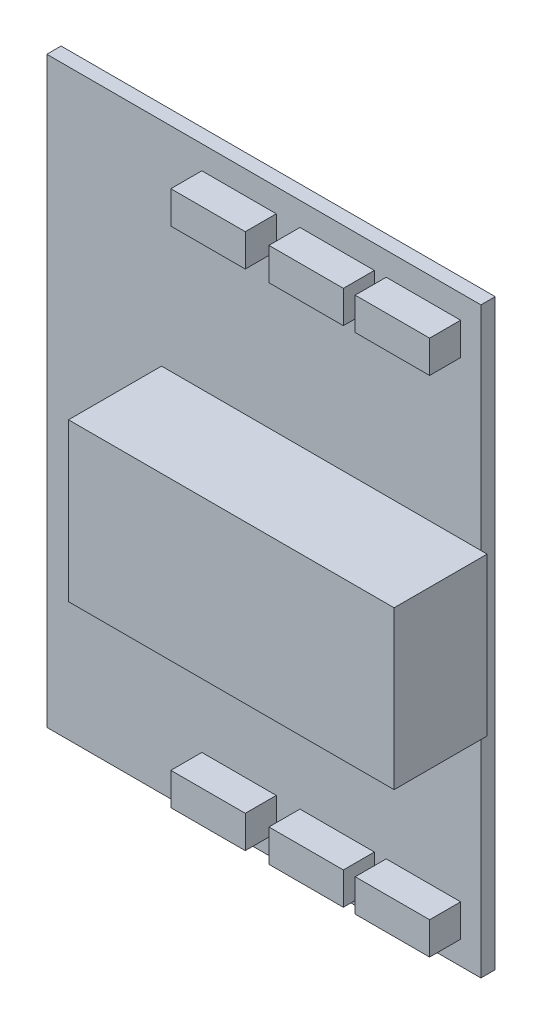
from build123d import *

# Parameters (mm, degrees)
SKETCH2_W           = 70
SKETCH2_H           = 94
BOSS_EXTRUDE1_DEPTH = 2.3
SKETCH3_W           = 51.5
SKETCH3_H           = 12.7
BOSS_EXTRUDE2_DEPTH = 15
SKETCH4_W           = 12
SKETCH4_H           = 5.220497566
BOSS_EXTRUDE3_DEPTH = 5


with BuildPart() as part:
    # Sketch2 → Boss-Extrude1 (new body)
    with BuildSketch(Plane.XY):
        Rectangle(SKETCH2_W, SKETCH2_H)
    extrude(amount=BOSS_EXTRUDE1_DEPTH)

    # Sketch3 → Boss-Extrude2 (add)
    with BuildSketch(Plane.XY.offset(2.3)):
        with Locations((9.25, 6.35)):
            Rectangle(SKETCH3_W, SKETCH3_H)
        with Locations((9.25, -6.35)):
            Rectangle(SKETCH3_W, SKETCH3_H)
        Polygon((35, 12.7), (35, 0), (35, -12.7), (36, -12.7), (36, 12.7), align=None)
    extrude(amount=BOSS_EXTRUDE2_DEPTH)

    # Sketch4 → Boss-Extrude3 (add)
    with BuildSketch(Plane.XY.offset(2.3)):
        with Locations((-4, 40.610248783)):
            Rectangle(SKETCH4_W, SKETCH4_H)
        with Locations((11.818181083, 40.610248783)):
            Rectangle(SKETCH4_W, SKETCH4_H)
        with Locations((25.725310397, 40.610248783)):
            Rectangle(SKETCH4_W, SKETCH4_H)
        with Locations((-4, -40.610248783)):
            Rectangle(SKETCH4_W, SKETCH4_H)
        with Locations((11.818181083, -40.610248783)):
            Rectangle(SKETCH4_W, SKETCH4_H)
        with Locations((25.725310397, -40.610248783)):
            Rectangle(SKETCH4_W, SKETCH4_H)
    extrude(amount=BOSS_EXTRUDE3_DEPTH)


solid = part.part
